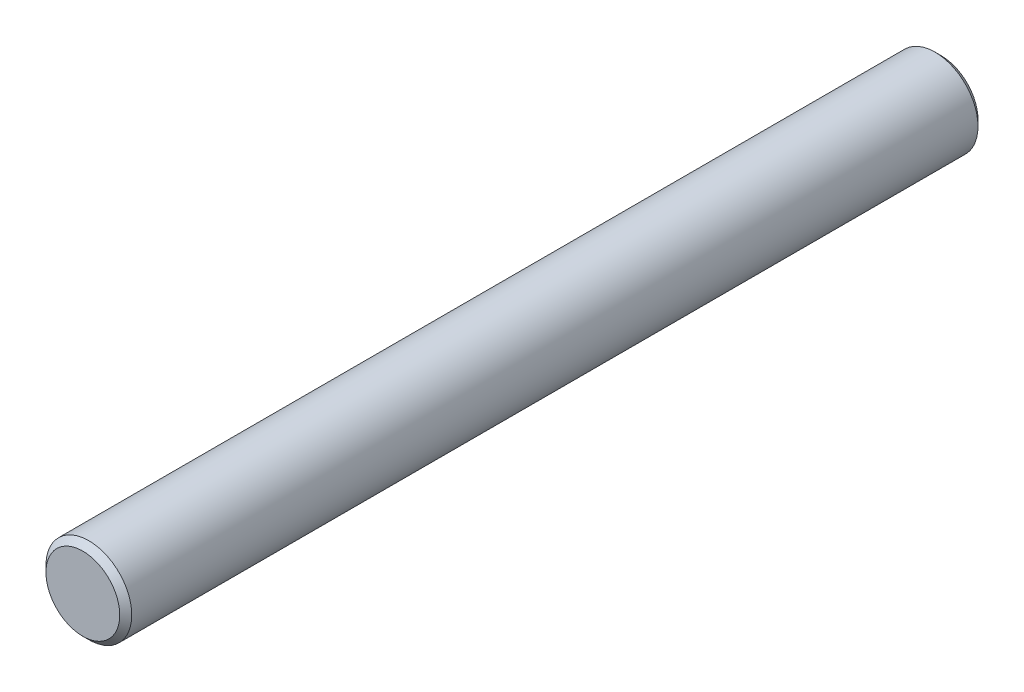
from build123d import *

# Parameters (mm, degrees)
BOSS_EXTRUDE1_DEPTH      = 25
BOSS_EXTRUDE1_DEPTH_BACK = 25
SKETCH3_R                = 2.5
CHAMFER1_SIZE            = 0.35


with BuildPart() as part:
    # Sketch3 → Boss-Extrude1 (new, two sides: drawn at the far end of the back side and taken through both)
    with BuildSketch(Plane.XY.offset(-BOSS_EXTRUDE1_DEPTH_BACK)):
        Circle(SKETCH3_R)
    extrude(amount=BOSS_EXTRUDE1_DEPTH + BOSS_EXTRUDE1_DEPTH_BACK)

    # Chamfer1
    chamfer1_edges = [part.edges().sort_by_distance(p)[0] for p in [
        (-2.5, 0, -25),
        (-2.5, 0, 25),
    ]]
    chamfer(chamfer1_edges, length=CHAMFER1_SIZE)


solid = part.part
